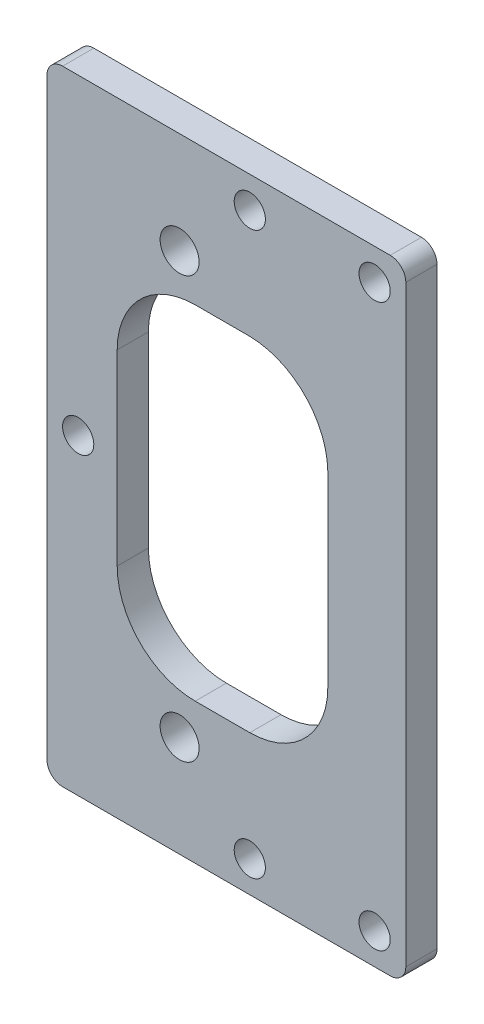
from build123d import *

# Parameters (mm, degrees)
SKETCH_1_W          = 41
SKETCH_1_H          = 40
SKETCH_1_R          = 1.25
SKETCH_1_R_2        = 1
EXTRUDE_1_DEPTH     = 2
SKETCH_4_W          = 18
SKETCH_4_H          = 22
CUT_EXTRUDE_1_DEPTH = 2
FILLET_2_R          = 2.5
FILLET_3_R          = 5
CUT_EXTRUDE_2_DEPTH = 2
FILLET_4_R          = 1
SKETCH_6_W          = 18
SKETCH_6_H          = 14
CUT_EXTRUDE_3_DEPTH = 10
FILLET_5_R          = 1
SKETCH_7_R          = 1
CUT_EXTRUDE_4_DEPTH = 10


with BuildPart() as part:
    # 草圖1 → 填料-伸長1 (new body)
    with BuildSketch(Plane.XY):
        with Locations((-5.216213198, -9.8375)):
            Rectangle(SKETCH_1_W, SKETCH_1_H)
        with Locations((-17.216213198, 3.6625)):
            Circle(SKETCH_1_R, mode=Mode.SUBTRACT)
        with Locations((-17.216213198, -23.3375)):
            Circle(SKETCH_1_R, mode=Mode.SUBTRACT)
        with Locations((12.783786802, -23.3375)):
            Circle(SKETCH_1_R, mode=Mode.SUBTRACT)
        with Locations((12.783786802, 3.6625)):
            Circle(SKETCH_1_R, mode=Mode.SUBTRACT)
        with Locations((-23.716213198, -9.8375)):
            Circle(SKETCH_1_R_2, mode=Mode.SUBTRACT)
    extrude(amount=EXTRUDE_1_DEPTH)

    # 草圖4 → 除料-伸長1 (cut)
    with BuildSketch(Plane(origin=(0, 0, 0), x_dir=(-1, 0, 0), z_dir=(0, 0, -1))):
        with Locations((-6.283786802, -9.8375)):
            Rectangle(SKETCH_4_W, SKETCH_4_H)
    extrude(amount=-CUT_EXTRUDE_1_DEPTH, mode=Mode.SUBTRACT)

    # 圓角2
    fillet_2_edges = [part.edges().sort_by_distance(p)[0] for p in [
        (15.283786802, -20.8375, 1),
        (15.283786802, 1.1625, 1),
    ]]
    fillet(fillet_2_edges, radius=FILLET_2_R)

    # 圓角3
    fillet_3_edges = [part.edges().sort_by_distance(p)[0] for p in [
        (-2.716213198, 1.1625, 1),
        (-2.716213198, -20.8375, 1),
    ]]
    fillet(fillet_3_edges, radius=FILLET_3_R)

    # 草圖5 → 除料-伸長2 (cut)
    with BuildSketch(Plane(origin=(0, 0, 0), x_dir=(-1, 0, 0), z_dir=(0, 0, -1))):
        with BuildLine():
            Line((7.716213198, -3.8375), (7.716213198, -15.8375))
            ThreePointArc((7.716213198, -15.8375), (9.180679292, -19.373033906), (12.716213198, -20.8375))
            Line((12.716213198, -20.8375), (16.216213198, -20.8375))
            ThreePointArc((16.216213198, -20.8375), (19.751747104, -19.373033906), (21.216213198, -15.8375))
            Line((21.216213198, -15.8375), (21.216213198, -3.8375))
            ThreePointArc((21.216213198, -3.8375), (19.751747104, -0.301966094), (16.216213198, 1.1625))
            Line((16.216213198, 1.1625), (12.716213198, 1.1625))
            ThreePointArc((12.716213198, 1.1625), (9.204017559, -0.325304361), (7.716213198, -3.8375))
        make_face()
    extrude(amount=-CUT_EXTRUDE_2_DEPTH, mode=Mode.SUBTRACT)

    # 圓角4
    fillet_4_edges = [part.edges().sort_by_distance(p)[0] for p in [
        (-25.716213198, 10.1625, 1),
        (15.283786802, 10.1625, 1),
        (15.283786802, -29.8375, 1),
        (-25.716213198, -29.8375, 1),
    ]]
    fillet(fillet_4_edges, radius=FILLET_4_R)

    # 草圖6 → 除料-伸長3 (cut)
    with BuildSketch(Plane(origin=(0, 0, 0), x_dir=(-1, 0, 0), z_dir=(0, 0, -1))):
        with Locations((-6.283786802, 3.1625)):
            Rectangle(SKETCH_6_W, SKETCH_6_H)
        with Locations((-6.283786802, -22.8375)):
            Rectangle(SKETCH_6_W, SKETCH_6_H)
    extrude(amount=-CUT_EXTRUDE_3_DEPTH, mode=Mode.SUBTRACT)

    # 圓角5
    fillet_5_edges = [part.edges().sort_by_distance(p)[0] for p in [
        (-2.716213198, 10.1625, 1),
        (-2.716213198, -29.8375, 1),
    ]]
    fillet(fillet_5_edges, radius=FILLET_5_R)

    # 草圖7 → 除料-伸長4 (cut)
    with BuildSketch(Plane(origin=(0, 0, 0), x_dir=(-1, 0, 0), z_dir=(0, 0, -1))):
        with Locations((4.716213198, -27.8375)):
            Circle(SKETCH_7_R)
        with Locations((12.716213198, -27.8375)):
            Circle(SKETCH_7_R)
        with Locations(Location((12.716213198, 8.1625, 0), (0, 0, 180))):
            Circle(SKETCH_7_R)
        with Locations(Location((4.716213198, 8.1625, 0), (0, 0, 180))):
            Circle(SKETCH_7_R)
    extrude(amount=-CUT_EXTRUDE_4_DEPTH, mode=Mode.SUBTRACT)


solid = part.part
